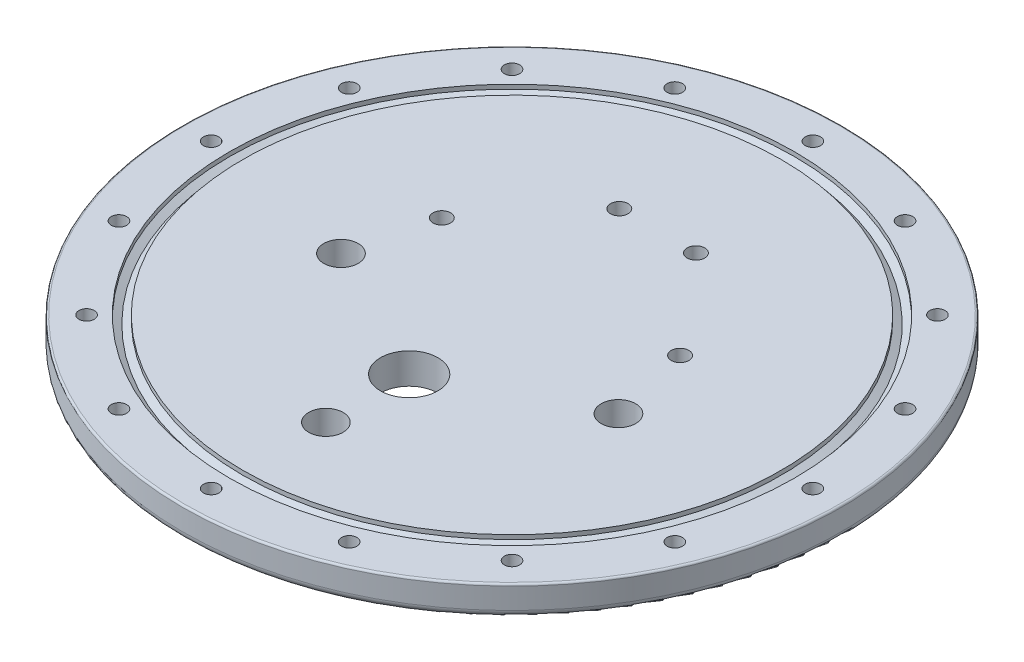
from build123d import *

# Parameters (mm, degrees)
SKETCH1_R           = 86
BOSS_EXTRUDE1_DEPTH = 8
CUT_EXTRUDE1_REACH  = 123.885
SKETCH2_R           = 2
SKETCH6_R           = 2.3
CUT_EXTRUDE3_DEPTH  = 6
CUT_EXTRUDE4_REACH  = 123.885
SKETCH8_R           = 4.5
SKETCH8_R_2         = 7.5
FILLET1_R           = 2
FILLET2_R           = 0.5


with BuildPart() as part:
    # Sketch1 → Boss-Extrude1 (new body)
    with BuildSketch(Plane(origin=(0, 0, 0), x_dir=(1, 0, 0), z_dir=(0, 1, 0))):
        with Locations(Location((0, 0, 0), (0, 0, 270))):
            Circle(SKETCH1_R)
    extrude(amount=BOSS_EXTRUDE1_DEPTH)

    # Sketch2 → Cut-Extrude1 (cut, up to next)
    with BuildSketch(Plane(origin=(0, 8, 0), x_dir=(1, 0, 0), z_dir=(0, 1, 0)), mode=Mode.PRIVATE) as cut_extrude1_sk1:
        with Locations(Location((0, 78.5, 0), (0, 0, 270))):
            Circle(SKETCH2_R)
    cut_extrude1_tool1 = extrude(cut_extrude1_sk1.sketch, amount=-CUT_EXTRUDE1_REACH, mode=Mode.PRIVATE) & part.part
    # Sketch2 → Cut-Extrude1 (cut, up to next)
    with BuildSketch(Plane(origin=(0, 8, 0), x_dir=(1, 0, 0), z_dir=(0, 1, 0)), mode=Mode.PRIVATE) as cut_extrude1_sk2:
        with Locations(Location((30.040649441, 72.524543302, 0), (0, 0, 270))):
            Circle(SKETCH2_R)
    cut_extrude1_tool2 = extrude(cut_extrude1_sk2.sketch, amount=-CUT_EXTRUDE1_REACH, mode=Mode.PRIVATE) & part.part
    # Sketch2 → Cut-Extrude1 (cut, up to next)
    with BuildSketch(Plane(origin=(0, 8, 0), x_dir=(1, 0, 0), z_dir=(0, 1, 0)), mode=Mode.PRIVATE) as cut_extrude1_sk3:
        with Locations(Location((55.507882323, 55.507882323, 0), (0, 0, 270))):
            Circle(SKETCH2_R)
    cut_extrude1_tool3 = extrude(cut_extrude1_sk3.sketch, amount=-CUT_EXTRUDE1_REACH, mode=Mode.PRIVATE) & part.part
    # Sketch2 → Cut-Extrude1 (cut, up to next)
    with BuildSketch(Plane(origin=(0, 8, 0), x_dir=(1, 0, 0), z_dir=(0, 1, 0)), mode=Mode.PRIVATE) as cut_extrude1_sk4:
        with Locations(Location((72.524543302, 30.040649441, 0), (0, 0, 270))):
            Circle(SKETCH2_R)
    cut_extrude1_tool4 = extrude(cut_extrude1_sk4.sketch, amount=-CUT_EXTRUDE1_REACH, mode=Mode.PRIVATE) & part.part
    # Sketch2 → Cut-Extrude1 (cut, up to next)
    with BuildSketch(Plane(origin=(0, 8, 0), x_dir=(1, 0, 0), z_dir=(0, 1, 0)), mode=Mode.PRIVATE) as cut_extrude1_sk5:
        with Locations(Location((78.5, 0, 0), (0, 0, 270))):
            Circle(SKETCH2_R)
    cut_extrude1_tool5 = extrude(cut_extrude1_sk5.sketch, amount=-CUT_EXTRUDE1_REACH, mode=Mode.PRIVATE) & part.part
    # Sketch2 → Cut-Extrude1 (cut, up to next)
    with BuildSketch(Plane(origin=(0, 8, 0), x_dir=(1, 0, 0), z_dir=(0, 1, 0)), mode=Mode.PRIVATE) as cut_extrude1_sk6:
        with Locations(Location((72.524543302, -30.040649441, 0), (0, 0, 270))):
            Circle(SKETCH2_R)
    cut_extrude1_tool6 = extrude(cut_extrude1_sk6.sketch, amount=-CUT_EXTRUDE1_REACH, mode=Mode.PRIVATE) & part.part
    # Sketch2 → Cut-Extrude1 (cut, up to next)
    with BuildSketch(Plane(origin=(0, 8, 0), x_dir=(1, 0, 0), z_dir=(0, 1, 0)), mode=Mode.PRIVATE) as cut_extrude1_sk7:
        with Locations(Location((55.507882323, -55.507882323, 0), (0, 0, 270))):
            Circle(SKETCH2_R)
    cut_extrude1_tool7 = extrude(cut_extrude1_sk7.sketch, amount=-CUT_EXTRUDE1_REACH, mode=Mode.PRIVATE) & part.part
    # Sketch2 → Cut-Extrude1 (cut, up to next)
    with BuildSketch(Plane(origin=(0, 8, 0), x_dir=(1, 0, 0), z_dir=(0, 1, 0)), mode=Mode.PRIVATE) as cut_extrude1_sk8:
        with Locations(Location((30.040649441, -72.524543302, 0), (0, 0, 270))):
            Circle(SKETCH2_R)
    cut_extrude1_tool8 = extrude(cut_extrude1_sk8.sketch, amount=-CUT_EXTRUDE1_REACH, mode=Mode.PRIVATE) & part.part
    # Sketch2 → Cut-Extrude1 (cut, up to next)
    with BuildSketch(Plane(origin=(0, 8, 0), x_dir=(1, 0, 0), z_dir=(0, 1, 0)), mode=Mode.PRIVATE) as cut_extrude1_sk9:
        with Locations(Location((0, -78.5, 0), (0, 0, 270))):
            Circle(SKETCH2_R)
    cut_extrude1_tool9 = extrude(cut_extrude1_sk9.sketch, amount=-CUT_EXTRUDE1_REACH, mode=Mode.PRIVATE) & part.part
    # Sketch2 → Cut-Extrude1 (cut, up to next)
    with BuildSketch(Plane(origin=(0, 8, 0), x_dir=(1, 0, 0), z_dir=(0, 1, 0)), mode=Mode.PRIVATE) as cut_extrude1_sk10:
        with Locations(Location((-30.040649441, -72.524543302, 0), (0, 0, 270))):
            Circle(SKETCH2_R)
    cut_extrude1_tool10 = extrude(cut_extrude1_sk10.sketch, amount=-CUT_EXTRUDE1_REACH, mode=Mode.PRIVATE) & part.part
    # Sketch2 → Cut-Extrude1 (cut, up to next)
    with BuildSketch(Plane(origin=(0, 8, 0), x_dir=(1, 0, 0), z_dir=(0, 1, 0)), mode=Mode.PRIVATE) as cut_extrude1_sk11:
        with Locations(Location((-55.507882323, -55.507882323, 0), (0, 0, 270))):
            Circle(SKETCH2_R)
    cut_extrude1_tool11 = extrude(cut_extrude1_sk11.sketch, amount=-CUT_EXTRUDE1_REACH, mode=Mode.PRIVATE) & part.part
    # Sketch2 → Cut-Extrude1 (cut, up to next)
    with BuildSketch(Plane(origin=(0, 8, 0), x_dir=(1, 0, 0), z_dir=(0, 1, 0)), mode=Mode.PRIVATE) as cut_extrude1_sk12:
        with Locations(Location((-72.524543302, -30.040649441, 0), (0, 0, 270))):
            Circle(SKETCH2_R)
    cut_extrude1_tool12 = extrude(cut_extrude1_sk12.sketch, amount=-CUT_EXTRUDE1_REACH, mode=Mode.PRIVATE) & part.part
    # Sketch2 → Cut-Extrude1 (cut, up to next)
    with BuildSketch(Plane(origin=(0, 8, 0), x_dir=(1, 0, 0), z_dir=(0, 1, 0)), mode=Mode.PRIVATE) as cut_extrude1_sk13:
        with Locations(Location((-78.5, 0, 0), (0, 0, 270))):
            Circle(SKETCH2_R)
    cut_extrude1_tool13 = extrude(cut_extrude1_sk13.sketch, amount=-CUT_EXTRUDE1_REACH, mode=Mode.PRIVATE) & part.part
    # Sketch2 → Cut-Extrude1 (cut, up to next)
    with BuildSketch(Plane(origin=(0, 8, 0), x_dir=(1, 0, 0), z_dir=(0, 1, 0)), mode=Mode.PRIVATE) as cut_extrude1_sk14:
        with Locations(Location((-72.524543302, 30.040649441, 0), (0, 0, 270))):
            Circle(SKETCH2_R)
    cut_extrude1_tool14 = extrude(cut_extrude1_sk14.sketch, amount=-CUT_EXTRUDE1_REACH, mode=Mode.PRIVATE) & part.part
    # Sketch2 → Cut-Extrude1 (cut, up to next)
    with BuildSketch(Plane(origin=(0, 8, 0), x_dir=(1, 0, 0), z_dir=(0, 1, 0)), mode=Mode.PRIVATE) as cut_extrude1_sk15:
        with Locations(Location((-55.507882323, 55.507882323, 0), (0, 0, 270))):
            Circle(SKETCH2_R)
    cut_extrude1_tool15 = extrude(cut_extrude1_sk15.sketch, amount=-CUT_EXTRUDE1_REACH, mode=Mode.PRIVATE) & part.part
    # Sketch2 → Cut-Extrude1 (cut, up to next)
    with BuildSketch(Plane(origin=(0, 8, 0), x_dir=(1, 0, 0), z_dir=(0, 1, 0)), mode=Mode.PRIVATE) as cut_extrude1_sk16:
        with Locations(Location((-30.040649441, 72.524543302, 0), (0, 0, 270))):
            Circle(SKETCH2_R)
    cut_extrude1_tool16 = extrude(cut_extrude1_sk16.sketch, amount=-CUT_EXTRUDE1_REACH, mode=Mode.PRIVATE) & part.part
    add(cut_extrude1_tool1.solids().sort_by_distance((0, 8, -78.5))[0], mode=Mode.SUBTRACT)
    add(cut_extrude1_tool2.solids().sort_by_distance((30.040649, 8, -72.524543))[0], mode=Mode.SUBTRACT)
    add(cut_extrude1_tool3.solids().sort_by_distance((55.507882, 8, -55.507882))[0], mode=Mode.SUBTRACT)
    add(cut_extrude1_tool4.solids().sort_by_distance((72.524543, 8, -30.040649))[0], mode=Mode.SUBTRACT)
    add(cut_extrude1_tool5.solids().sort_by_distance((78.5, 8, 0))[0], mode=Mode.SUBTRACT)
    add(cut_extrude1_tool6.solids().sort_by_distance((72.524543, 8, 30.040649))[0], mode=Mode.SUBTRACT)
    add(cut_extrude1_tool7.solids().sort_by_distance((55.507882, 8, 55.507882))[0], mode=Mode.SUBTRACT)
    add(cut_extrude1_tool8.solids().sort_by_distance((30.040649, 8, 72.524543))[0], mode=Mode.SUBTRACT)
    add(cut_extrude1_tool9.solids().sort_by_distance((0, 8, 78.5))[0], mode=Mode.SUBTRACT)
    add(cut_extrude1_tool10.solids().sort_by_distance((-30.040649, 8, 72.524543))[0], mode=Mode.SUBTRACT)
    add(cut_extrude1_tool11.solids().sort_by_distance((-55.507882, 8, 55.507882))[0], mode=Mode.SUBTRACT)
    add(cut_extrude1_tool12.solids().sort_by_distance((-72.524543, 8, 30.040649))[0], mode=Mode.SUBTRACT)
    add(cut_extrude1_tool13.solids().sort_by_distance((-78.5, 8, 0))[0], mode=Mode.SUBTRACT)
    add(cut_extrude1_tool14.solids().sort_by_distance((-72.524543, 8, -30.040649))[0], mode=Mode.SUBTRACT)
    add(cut_extrude1_tool15.solids().sort_by_distance((-55.507882, 8, -55.507882))[0], mode=Mode.SUBTRACT)
    add(cut_extrude1_tool16.solids().sort_by_distance((-30.040649, 8, -72.524543))[0], mode=Mode.SUBTRACT)

    # Sketch6 → Cut-Extrude3 (cut)
    with BuildSketch(Plane(origin=(0, 8, 0), x_dir=(1, 0, 0), z_dir=(0, 1, 0))):
        with Locations(Location((-10, 38, 0), (0, 0, 270))):
            Circle(SKETCH6_R)
        with Locations(Location((10, 38, 0), (0, 0, 270))):
            Circle(SKETCH6_R)
        with Locations(Location((-31.087993015, 12.771112084, 0), (0, 0, 270))):
            Circle(SKETCH6_R)
        with Locations(Location((31.092199918, 12.771112084, 0), (0, 0, 270))):
            Circle(SKETCH6_R)
    extrude(amount=-CUT_EXTRUDE3_DEPTH, mode=Mode.SUBTRACT)

    # Sketch8 → Cut-Extrude4 (cut, up to next)
    with BuildSketch(Plane(origin=(0, 8, 0), x_dir=(1, 0, 0), z_dir=(0, 1, 0)), mode=Mode.PRIVATE) as cut_extrude4_sk1:
        with Locations(Location((-36.2, -8.428843365, 0), (0, 0, 270))):
            Circle(SKETCH8_R)
    cut_extrude4_tool1 = extrude(cut_extrude4_sk1.sketch, amount=-CUT_EXTRUDE4_REACH, mode=Mode.PRIVATE) & part.part
    # Sketch8 → Cut-Extrude4 (cut, up to next)
    with BuildSketch(Plane(origin=(0, 8, 0), x_dir=(1, 0, 0), z_dir=(0, 1, 0)), mode=Mode.PRIVATE) as cut_extrude4_sk2:
        with Locations(Location((36.2, -8.428843365, 0), (0, 0, 270))):
            Circle(SKETCH8_R)
    cut_extrude4_tool2 = extrude(cut_extrude4_sk2.sketch, amount=-CUT_EXTRUDE4_REACH, mode=Mode.PRIVATE) & part.part
    # Sketch8 → Cut-Extrude4 (cut, up to next)
    with BuildSketch(Plane(origin=(0, 8, 0), x_dir=(1, 0, 0), z_dir=(0, 1, 0)), mode=Mode.PRIVATE) as cut_extrude4_sk3:
        with Locations(Location((0, -48.566515497, 0), (0, 0, 270))):
            Circle(SKETCH8_R)
    cut_extrude4_tool3 = extrude(cut_extrude4_sk3.sketch, amount=-CUT_EXTRUDE4_REACH, mode=Mode.PRIVATE) & part.part
    # Sketch8 → Cut-Extrude4 (cut, up to next)
    with BuildSketch(Plane(origin=(0, 8, 0), x_dir=(1, 0, 0), z_dir=(0, 1, 0)), mode=Mode.PRIVATE) as cut_extrude4_sk4:
        with Locations(Location((0, -26.826761031, 0), (0, 0, 270))):
            Circle(SKETCH8_R_2)
    cut_extrude4_tool4 = extrude(cut_extrude4_sk4.sketch, amount=-CUT_EXTRUDE4_REACH, mode=Mode.PRIVATE) & part.part
    add(cut_extrude4_tool1.solids().sort_by_distance((-36.2, 8, 8.428843))[0], mode=Mode.SUBTRACT)
    add(cut_extrude4_tool2.solids().sort_by_distance((36.2, 8, 8.428843))[0], mode=Mode.SUBTRACT)
    add(cut_extrude4_tool3.solids().sort_by_distance((0, 8, 48.566515))[0], mode=Mode.SUBTRACT)
    add(cut_extrude4_tool4.solids().sort_by_distance((0, 8, 26.826761))[0], mode=Mode.SUBTRACT)

    # Sketch4 → Cut-Revolve1 (revolve, cut)
    with BuildSketch(Plane.XY, mode=Mode.PRIVATE) as cut_revolve1_sk:
        Polygon((73.75, 6.880362971), (73.75, 8), (70.25, 8), (70.25, 6.880362971), (72, 5.87), align=None)
    revolve(cut_revolve1_sk.sketch.rotate(Axis((0, 0, 0), (0, 1, 0)), 90), axis=Axis((0, 0, 0), (0, 1, 0)), mode=Mode.SUBTRACT)

    # Fillet1
    fillet1_edges = [part.edges().sort_by_distance(p)[0] for p in [
        (0, 0, -86),
    ]]
    fillet(fillet1_edges, radius=FILLET1_R)

    # Fillet2
    fillet2_edges = [part.edges().sort_by_distance(p)[0] for p in [
        (0, 8, -86),
    ]]
    fillet(fillet2_edges, radius=FILLET2_R)


solid = part.part
